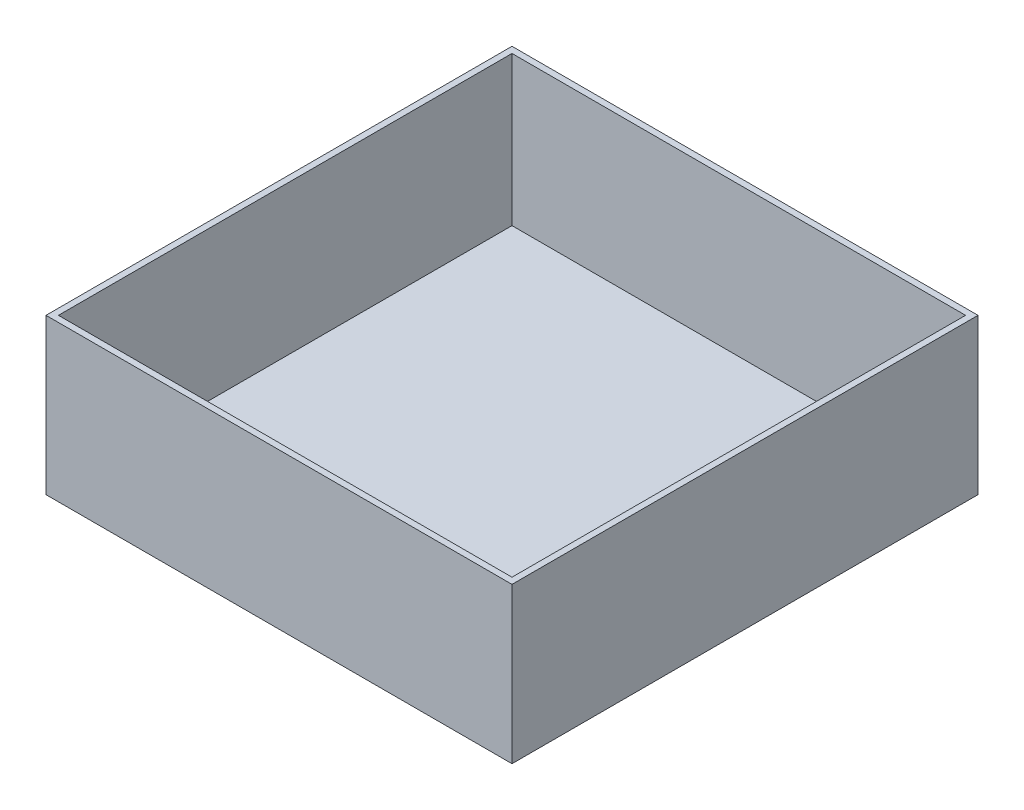
from build123d import *

# Parameters (mm, degrees)
SKETCH1_W           = 150
SKETCH1_H           = 150
BOSS_EXTRUDE1_DEPTH = 50
CUT_EXTRUDE1_START  = 2
SKETCH2_W           = 146
SKETCH2_H           = 146
CUT_EXTRUDE1_DEPTH  = 48


with BuildPart() as part:
    # Sketch1 → Boss-Extrude1 (new body)
    with BuildSketch(Plane(origin=(0, 0, 0), x_dir=(1, 0, 0), z_dir=(0, 1, 0))):
        Rectangle(SKETCH1_W, SKETCH1_H)
    extrude(amount=BOSS_EXTRUDE1_DEPTH)

    # Sketch2 → Cut-Extrude1 (cut)
    with BuildSketch(Plane(origin=(0, 0, 0), x_dir=(1, 0, 0), z_dir=(0, 1, 0)).offset(CUT_EXTRUDE1_START)):
        Rectangle(SKETCH2_W, SKETCH2_H)
    extrude(amount=CUT_EXTRUDE1_DEPTH, mode=Mode.SUBTRACT)


solid = part.part
